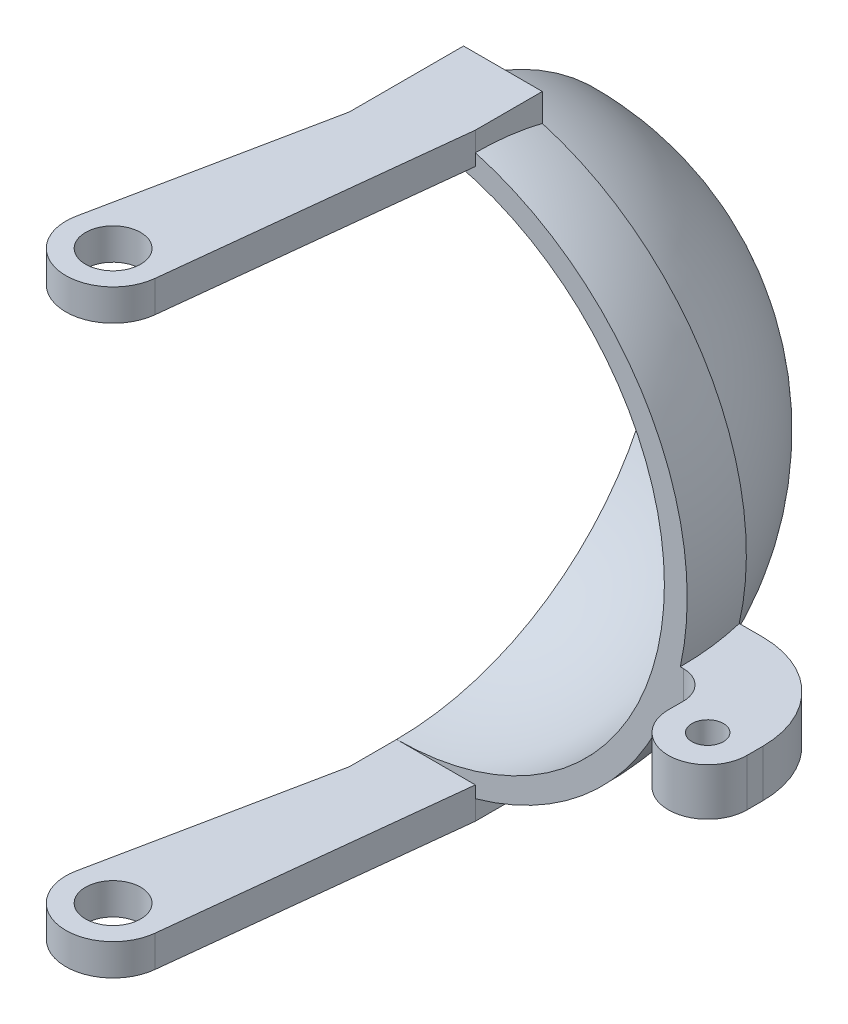
from build123d import *

# Parameters (mm, degrees)
REVOLVE_1_ANGLE      = 90
REVOLVE_2_ANGLE      = 180
EXTRUDE_1_REACH      = 52.557
EXTRUDE_1_END_RADIUS = 18.45
EXTRUDE_START        = -19
SKETCH_3_W           = 5
SKETCH_3_H           = 4.25
SKETCH_4_R           = 1.75
EXTRUDE_2_DEPTH      = 2
EXTRUDE_3_REACH      = 38.483
EXTRUDE_3_END_RADIUS = 18.45
SKETCH_7_W           = 4.25
SKETCH_7_H           = 3
SKETCH_8_R           = 1
EXTRUDE_4_DEPTH      = 3
FILLET_1_R           = 6
FILLET_2_R           = 1.8


with BuildPart() as part:
    # 草图1 → 旋转1 (revolve)
    with BuildSketch(Plane(origin=(0, 0, 0), x_dir=(0, 0, -1), z_dir=(1, 0, 0))):
        with BuildLine():
            Line((0, 17.75), (0, 17))
            ThreePointArc((0, 17), (17, 0), (0, -17))
            Line((0, -17), (0, -17.75))
            ThreePointArc((0, -17.75), (17.75, 0), (0, 17.75))
        make_face()
    revolve(axis=Axis((0, 17.75, 0), (0, -1, 0)), revolution_arc=REVOLVE_1_ANGLE)

    # 草图2 → 旋转2 (revolve)
    with BuildSketch(Plane(origin=(0, 0, 0), x_dir=(0, 0, -1), z_dir=(1, 0, 0))):
        with BuildLine():
            Line((4.25, 17.953829675), (4.25, 17.23368794))
            ThreePointArc((4.25, 17.23368794), (2.140623632, 17.620449213), (0, 17.75))
            Line((0, 17.75), (0, 18.45))
            ThreePointArc((0, 18.45), (2.139432459, 18.325537612), (4.25, 17.953829675))
        make_face()
    revolve(axis=Axis((0, 0, 0), (0, 0, -1)), revolution_arc=REVOLVE_2_ANGLE)

    # 凸台-拉伸1: up to this sphere (the profile starts outside it)
    extrude_1_end = Location((0, 0, 0)) * Sphere(EXTRUDE_1_END_RADIUS, mode=Mode.PRIVATE)
    # 草图3 → 凸台-拉伸1 (add, up to the surface)
    with BuildSketch(Plane(origin=(0, 0, 0), x_dir=(1, 0, 0), z_dir=(0, 1, 0)).offset(EXTRUDE_START), mode=Mode.PRIVATE) as extrude_1_sk1:
        with Locations((2.5, 2.125)):
            Rectangle(SKETCH_3_W, SKETCH_3_H)
    extrude_1_tool1 = extrude(extrude_1_sk1.sketch, amount=EXTRUDE_1_REACH, mode=Mode.PRIVATE) - extrude_1_end
    extrude_1 = extrude_1_tool1.solids().sort_by_distance((2.5, -19, -2.125))[0]
    add(extrude_1)

    # 草图4 → 凸台-拉伸2 (add)
    with BuildSketch(Plane(origin=(0, -19, 0), x_dir=(-1, 0, 0), z_dir=(0, -1, 0))):
        with BuildLine():
            Line((-2.981979374, -18.328327604), (-5, 0))
            Line((-5, 0), (0, 0))
            Line((0, 0), (0, -3))
            Line((0, -3), (2.939387691, -17.4))
            ThreePointArc((2.939387691, -17.4), (0.464652072, -20.963797978), (-2.981979374, -18.328327604))
        make_face()
        with Locations(Location((0, -18, 0), (0, 0, 90))):
            Circle(SKETCH_4_R, mode=Mode.SUBTRACT)
    extrude_2 = extrude(amount=-EXTRUDE_2_DEPTH)

    # 镜向1: 凸台-拉伸1, 凸台-拉伸2 across plane
    add(extrude_1.mirror(Plane.ZX))
    add(extrude_2.mirror(Plane.ZX))

    # 凸台-拉伸3: up to this sphere (the profile starts outside it)
    extrude_3_end = Location((0, 0, 0)) * Sphere(EXTRUDE_3_END_RADIUS, mode=Mode.PRIVATE)
    # 草图7 → 凸台-拉伸3 (add, up to the surface)
    with BuildSketch(Plane(origin=(20, 0, 0), x_dir=(0, 0, -1), z_dir=(1, 0, 0)), mode=Mode.PRIVATE) as extrude_3_sk1:
        with Locations((2.125, -5.5)):
            Rectangle(SKETCH_7_W, SKETCH_7_H)
    extrude_3_tool1 = extrude(extrude_3_sk1.sketch, amount=-EXTRUDE_3_REACH, mode=Mode.PRIVATE) - extrude_3_end
    add(extrude_3_tool1.solids().sort_by_distance((20, -5.5, -2.125))[0])

    # 草图8 → 凸台-拉伸4 (add)
    with BuildSketch(Plane.XZ.offset(7)):
        with BuildLine():
            ThreePointArc((20, 2.75), (22.5, 5.25), (25, 2.75))
            Line((25, 2.75), (25, -4.25))
            Line((25, -4.25), (20, -4.25))
            Line((20, -4.25), (20, 0))
            Line((20, 0), (20, 2.75))
        make_face()
        with Locations(Location((22.5, 2.75, 0), (0, 0, 270))):
            Circle(SKETCH_8_R, mode=Mode.SUBTRACT)
    extrude(amount=-EXTRUDE_4_DEPTH)

    # 圆角1
    fillet_1_edges = [part.edges().sort_by_distance(p)[0] for p in [
        (25, -5.5, -4.25),
    ]]
    fillet(fillet_1_edges, radius=FILLET_1_R)

    # 圆角2
    fillet_2_edges = [part.edges().sort_by_distance(p)[0] for p in [
        (20, -5.5, 0),
    ]]
    fillet(fillet_2_edges, radius=FILLET_2_R)


solid = part.part
